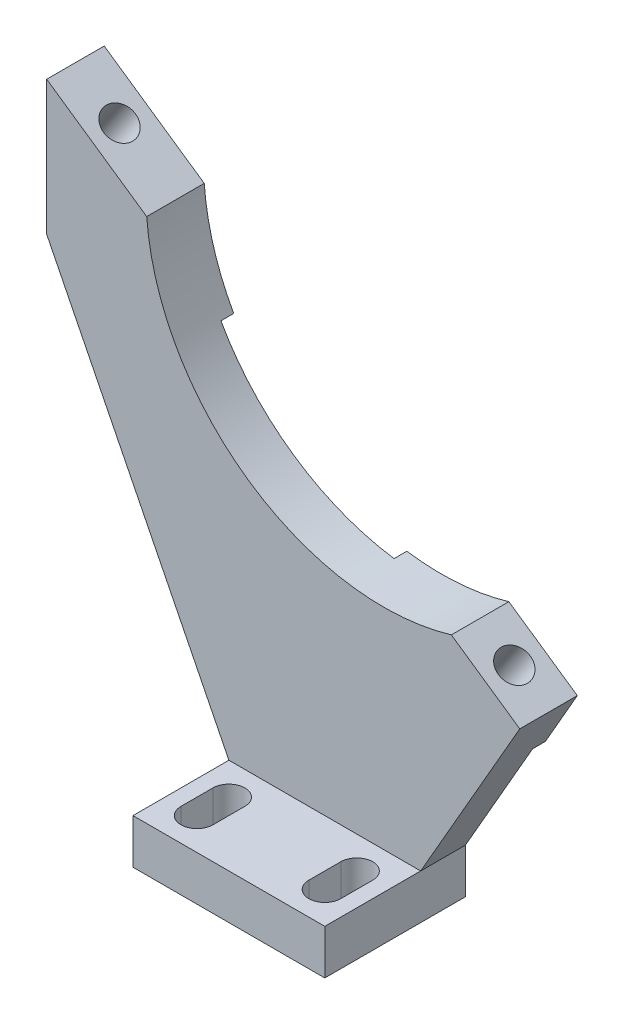
from build123d import *

# Parameters (mm, degrees)
SKETCH1_W                       = 30
SKETCH1_H                       = 22
BOSS_EXTRUDE1_DEPTH             = 7
BOSS_EXTRUDE2_DEPTH             = 7
BOSS_EXTRUDE3_START             = 2
BOSS_EXTRUDE3_DEPTH             = 2
TAP_DRILL_FOR_M6X1_0_TAP2_D     = 5
TAP_DRILL_FOR_M6X1_0_TAP2_DEPTH = 8
TAP_DRILL_FOR_M6X1_0_TAP2_TIP   = 1.502151548


with BuildPart() as part:
    # Sketch1 → Boss-Extrude1 (new body)
    with BuildSketch(Plane(origin=(0, 0, 0), x_dir=(1, 0, 0), z_dir=(0, 1, 0))):
        with Locations((0, 3.5)):
            Rectangle(SKETCH1_W, SKETCH1_H)
        with BuildLine():
            ThreePointArc((-7.5, -2.5), (-10, -5), (-12.5, -2.5))
            Line((-12.5, -2.5), (-12.5, 2.5))
            ThreePointArc((-12.5, 2.5), (-10, 5), (-7.5, 2.5))
            Line((-7.5, 2.5), (-7.5, -2.5))
        make_face(mode=Mode.SUBTRACT)
        with BuildLine():
            ThreePointArc((12.5, -2.5), (10, -5), (7.5, -2.5))
            Line((7.5, -2.5), (7.5, 2.5))
            ThreePointArc((7.5, 2.5), (10, 5), (12.5, 2.5))
            Line((12.5, 2.5), (12.5, -2.5))
        make_face(mode=Mode.SUBTRACT)
    extrude(amount=BOSS_EXTRUDE1_DEPTH)

    # Sketch2 → Boss-Extrude2 (add)
    with BuildSketch(Plane(origin=(0, 0, -14.5), x_dir=(-1, 0, 0), z_dir=(0, 0, -1))):
        with BuildLine():
            Line((-15, 7), (15, 7))
            Line((15, 7), (43.5, 64))
            Line((43.5, 64), (43.5, 85))
            Line((43.5, 85), (27.855550733, 74.218014694))
            ThreePointArc((27.855550733, 74.218014694), (11.88121166, 46.405371431), (-19.795903133, 41.377147841))
            Line((-19.795903133, 41.377147841), (-30.5, 34))
            Line((-30.5, 34), (-15, 7))
        make_face()
    extrude(amount=-BOSS_EXTRUDE2_DEPTH)

    # Sketch3 → Boss-Extrude3 (add)
    with BuildSketch(Plane(origin=(0, 0, -14.5), x_dir=(-1, 0, 0), z_dir=(0, 0, -1)).offset(BOSS_EXTRUDE3_START)):
        with BuildLine():
            Line((-19.795903133, 41.377147841), (-30.5, 34))
            Line((-30.5, 34), (-25.504418015, 25.298018478))
            Line((-25.504418015, 25.298018478), (-3.837244639, 40.230800129))
            ThreePointArc((-3.837244639, 40.230800129), (-11.878974739, 39.935272554), (-19.795903133, 41.377147841))
        make_face()
        with BuildLine():
            Line((43.5, 85), (27.855550733, 74.218014694))
            ThreePointArc((27.855550733, 74.218014694), (26.38496828, 66.306368419), (23.246350456, 58.896521073))
            Line((23.246350456, 58.896521073), (43.5, 72.85511738))
            Line((43.5, 72.85511738), (43.5, 85))
        make_face()
    extrude(amount=-BOSS_EXTRUDE3_DEPTH)

    # Tap Drill for M6x1.0 Tap2
    with Locations(Plane(origin=(25.708369444, 37.302339978, 0), x_dir=(0.8233920666857286, -0.5674729108239484, 0), z_dir=(0.5674729108239484, 0.8233920666857286, 0))):
        with Locations((-75.680620934, 12), (-0.680620934, 12)):
            Hole(TAP_DRILL_FOR_M6X1_0_TAP2_D / 2, depth=TAP_DRILL_FOR_M6X1_0_TAP2_DEPTH)
            with Locations((0, 0, -(TAP_DRILL_FOR_M6X1_0_TAP2_DEPTH + TAP_DRILL_FOR_M6X1_0_TAP2_TIP / 2))):  # 118° drill point
                Cone(0, TAP_DRILL_FOR_M6X1_0_TAP2_D / 2, TAP_DRILL_FOR_M6X1_0_TAP2_TIP, mode=Mode.SUBTRACT)


solid = part.part
